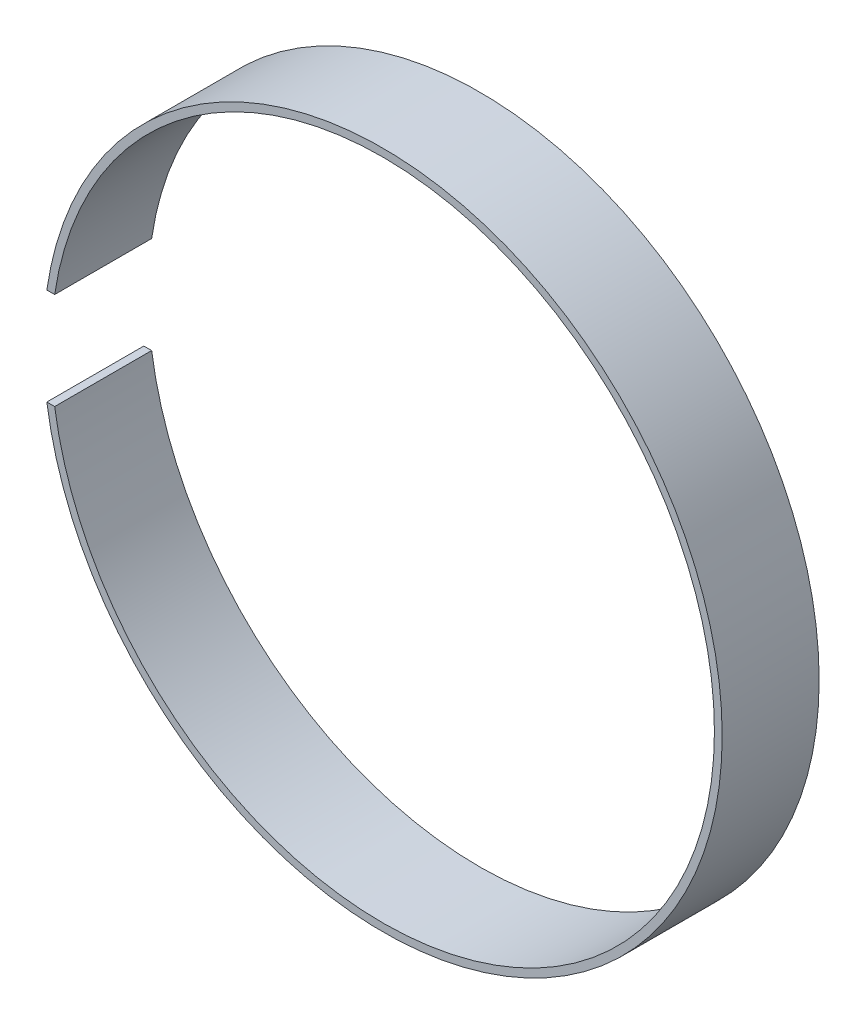
from build123d import *

# Parameters (mm, degrees)
BOSS_EXTRUDE1_DEPTH = 250


with BuildPart() as part:
    # Sketch1 → Boss-Extrude1 (new body)
    with BuildSketch(Plane.XY):
        with BuildLine():
            Line((-866.025403784, -125), (-845.813218152, -125))
            ThreePointArc((-845.813218152, -125), (855, 0), (-845.813218152, 125))
            Line((-845.813218152, 125), (-866.025403784, 125))
            ThreePointArc((-866.025403784, 125), (875, 0), (-866.025403784, -125))
        make_face()
    extrude(amount=BOSS_EXTRUDE1_DEPTH)


solid = part.part
